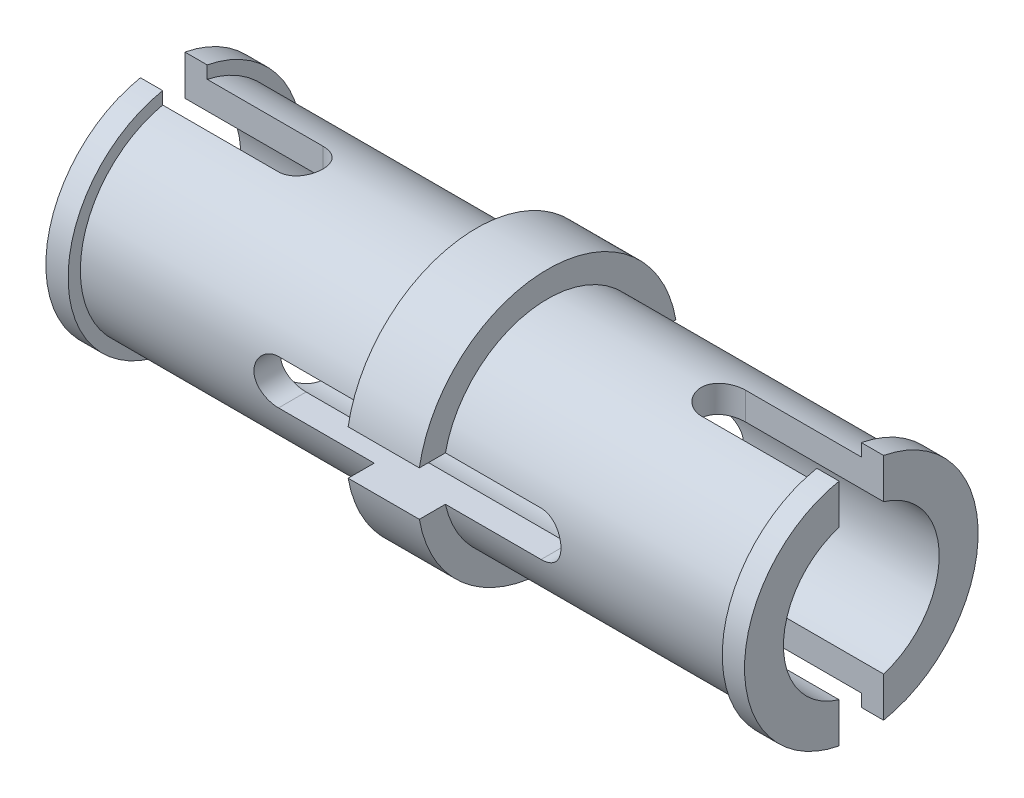
from build123d import *

# Parameters (mm, degrees)
SKETCH1_R              = 2.925
SKETCH1_R_2            = 1.75
MIDDLE_RING_DEPTH      = 0.8
SKETCH2_R              = 2.35
SKETCH2_R_2            = 1.75
OUTER_BODY_DEPTH       = 7.35
SKETCH3_R              = 2.625
SKETCH3_R_2            = 1.75
OUTER_RIM_DEPTH        = 0.5
MIDDLE_SLOT_DEPTH      = 9.873204044
MIDDLE_SLOT_DEPTH_BACK = 9.873204044
SIDE_SLOTS_DEPTH       = 9.859105574
SIDE_SLOTS_DEPTH_BACK  = 9.859105574


with BuildPart() as part:
    # Sketch1 → Middle Ring (new, symmetric)
    with BuildSketch(Plane(origin=(0, 0, 0), x_dir=(0, 0, -1), z_dir=(1, 0, 0))):
        Circle(SKETCH1_R)
        Circle(SKETCH1_R_2, mode=Mode.SUBTRACT)
    extrude(amount=MIDDLE_RING_DEPTH, both=True)

    # Sketch2 → Outer Body (add, symmetric)
    with BuildSketch(Plane(origin=(0, 0, 0), x_dir=(0, 0, -1), z_dir=(1, 0, 0))):
        Circle(SKETCH2_R)
        Circle(SKETCH2_R_2, mode=Mode.SUBTRACT)
    extrude(amount=OUTER_BODY_DEPTH, both=True)

    # Sketch3 → Outer Rim (add)
    with BuildSketch(Plane(origin=(7.35, 0, 0), x_dir=(0, 0, -1), z_dir=(1, 0, 0))):
        Circle(SKETCH3_R)
        Circle(SKETCH3_R_2, mode=Mode.SUBTRACT)
    outer_rim = extrude(amount=OUTER_RIM_DEPTH)

    # Mirror1: Outer Rim across plane
    add(outer_rim.mirror(Plane(origin=(0, 0, 0), x_dir=(0, 0, 1), z_dir=(1, 0, 0))))

    # Sketch4 → Middle Slot (cut, two sides: drawn at the far end of the back side and taken through both)
    with BuildSketch(Plane.XY.offset(-MIDDLE_SLOT_DEPTH_BACK)):
        with BuildLine():
            Line((2.95, -0.5), (-2.95, -0.5))
            ThreePointArc((-2.95, -0.5), (-3.45, 0), (-2.95, 0.5))
            Line((-2.95, 0.5), (2.95, 0.5))
            ThreePointArc((2.95, 0.5), (3.45, 0), (2.95, -0.5))
        make_face()
    extrude(amount=MIDDLE_SLOT_DEPTH + MIDDLE_SLOT_DEPTH_BACK, mode=Mode.SUBTRACT)

    # Sketch5 → Side Slots (cut, two sides: drawn at the far end of the back side and taken through both)
    with BuildSketch(Plane(origin=(0, 0, 0), x_dir=(1, 0, 0), z_dir=(0, 1, 0)).offset(-SIDE_SLOTS_DEPTH_BACK)):
        with BuildLine():
            Line((10.95, -0.5), (4.75, -0.5))
            ThreePointArc((4.75, -0.5), (4.25, 0), (4.75, 0.5))
            Line((4.75, 0.5), (10.95, 0.5))
            ThreePointArc((10.95, 0.5), (11.45, 0), (10.95, -0.5))
        make_face()
        with BuildLine():
            Line((-10.95, -0.5), (-4.75, -0.5))
            ThreePointArc((-4.75, -0.5), (-4.25, 0), (-4.75, 0.5))
            Line((-4.75, 0.5), (-10.95, 0.5))
            ThreePointArc((-10.95, 0.5), (-11.45, 0), (-10.95, -0.5))
        make_face()
    extrude(amount=SIDE_SLOTS_DEPTH + SIDE_SLOTS_DEPTH_BACK, mode=Mode.SUBTRACT)


solid = part.part
